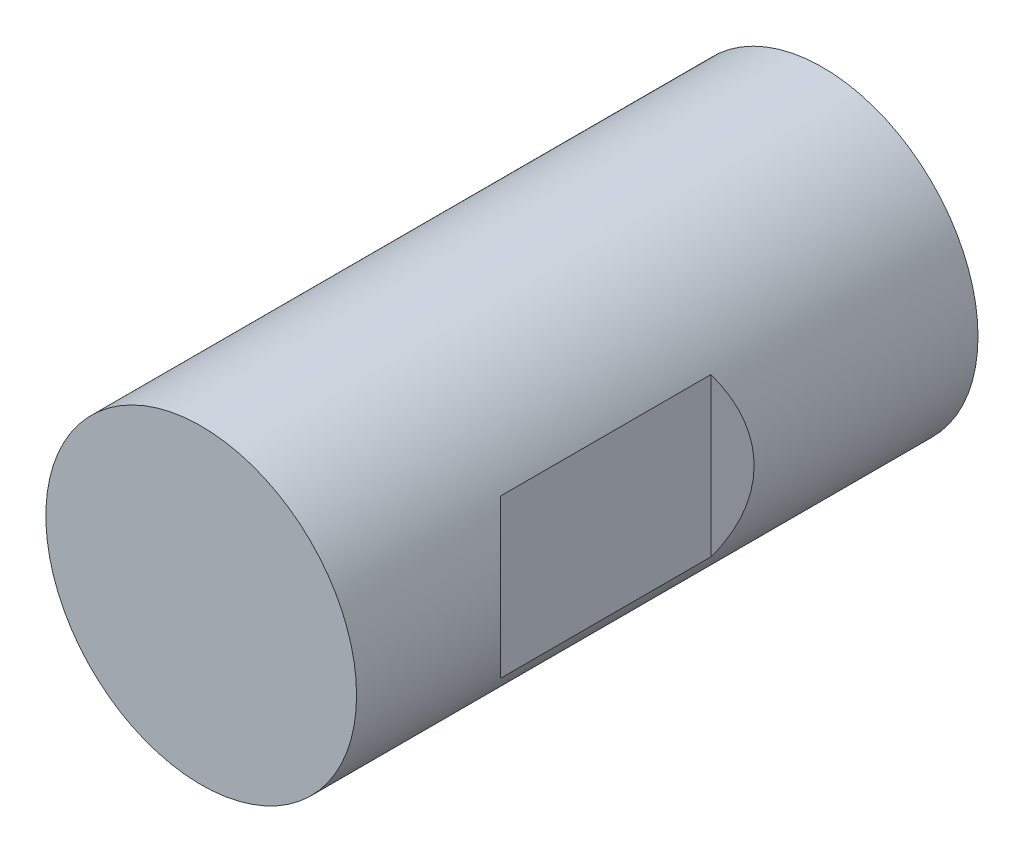
from build123d import *

# Parameters (mm, degrees)
SKETCH1_R               = 15.5
BOSS_EXTRUDE1_DEPTH     = 62
CUT_EXTRUDE1_DEPTH      = 66.76093065
CUT_EXTRUDE1_DEPTH_BACK = 66.76093065


with BuildPart() as part:
    # Sketch1 → Boss-Extrude1 (new body)
    with BuildSketch(Plane.XY):
        Circle(SKETCH1_R)
    extrude(amount=BOSS_EXTRUDE1_DEPTH)

    # Sketch2 → Cut-Extrude1 (cut, two sides: drawn at the far end of the back side and taken through both)
    with BuildSketch(Plane(origin=(0, 0, 0), x_dir=(1, 0, 0), z_dir=(0, 1, 0)).offset(-CUT_EXTRUDE1_DEPTH_BACK)):
        Polygon((-15.5, -22.33712703), (-13.35, -24.5), (-13.35, -45.5), (-15.5, -47.66287297), align=None)
        Polygon((15.5, -47.66287297), (13.35, -45.5), (13.35, -24.5), (15.5, -22.33712703), align=None)
    extrude(amount=CUT_EXTRUDE1_DEPTH + CUT_EXTRUDE1_DEPTH_BACK, mode=Mode.SUBTRACT)


solid = part.part
